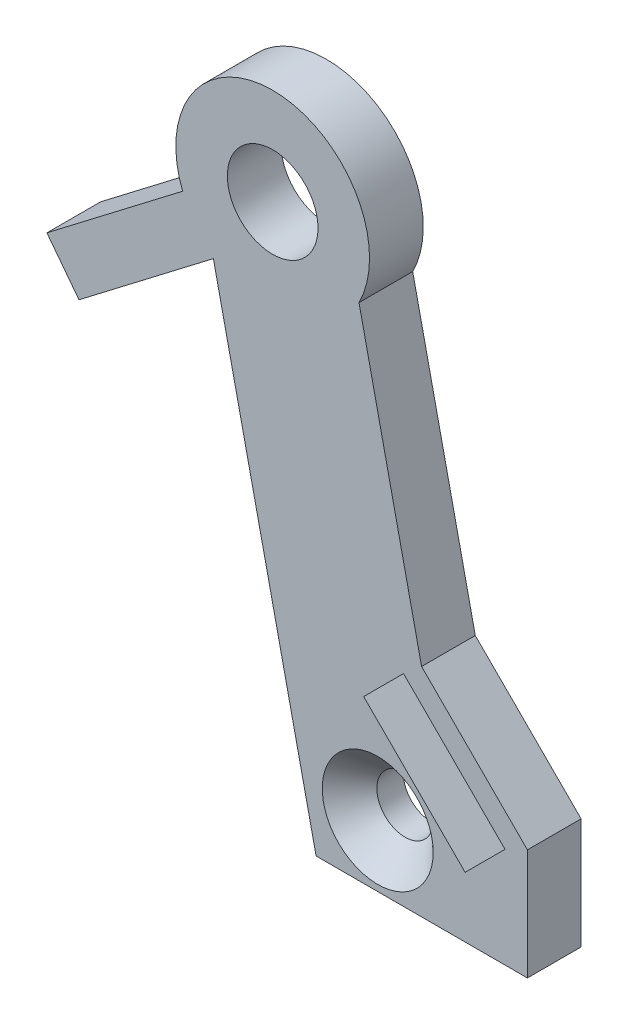
from build123d import *

# Parameters (mm, degrees)
SKETCH1_R           = 1.5
SKETCH1_R_2         = 2.575
BOSS_EXTRUDE1_DEPTH = 3.05


with BuildPart() as part:
    # Sketch1 → Boss-Extrude1 (new body)
    with BuildSketch(Plane.XY):
        with BuildLine():
            Line((5.98959236, 12.314316255), (2.43581293, 28.4362191))
            ThreePointArc((2.43581293, 28.4362191), (-2.208633676, 36.424535456), (-7.57966444, 28.905485582))
            Line((-7.57966444, 28.905485582), (-15.289043869, 23.004605125))
            Line((-15.289043869, 23.004605125), (-13.465626641, 20.622347873))
            Line((-13.465626641, 20.622347873), (-5.833523684, 26.464079701))
            Line((-5.833523684, 26.464079701), (0, 0))
            Line((0, 0), (12, 0))
            Line((12, 0), (12, 6.303908615))
            Line((12, 6.303908615), (5.98959236, 12.314316255))
        make_face()
        with Locations((3.5, 3.5)):
            Circle(SKETCH1_R, mode=Mode.SUBTRACT)
        Polygon((10.727207794, 5.692209589), (8.517499103, 3.482500897), (8.464466094, 3.429467889), (2.701545827, 9.192388155), (4.964287527, 11.455129855), align=None, mode=Mode.SUBTRACT)
        with Locations((-2.466048994, 30.930562636)):
            Circle(SKETCH1_R_2, mode=Mode.SUBTRACT)
    extrude(amount=BOSS_EXTRUDE1_DEPTH)

    # Sketch3 → CSK for M3 Flat Head Machine Screw1 (revolve, cut)
    with BuildSketch(Plane(origin=(3.5, 3.5, 3.05), x_dir=(0, -1, 0), z_dir=(1, 0, 0))):
        Polygon((0, 0), (0, 3.05), (1.6, 3.05), (1.6, 1.55), (3.15, 0), align=None)
    revolve(axis=Axis((3.5, 3.5, 9.4), (0, 0, -1)), mode=Mode.SUBTRACT)


solid = part.part
